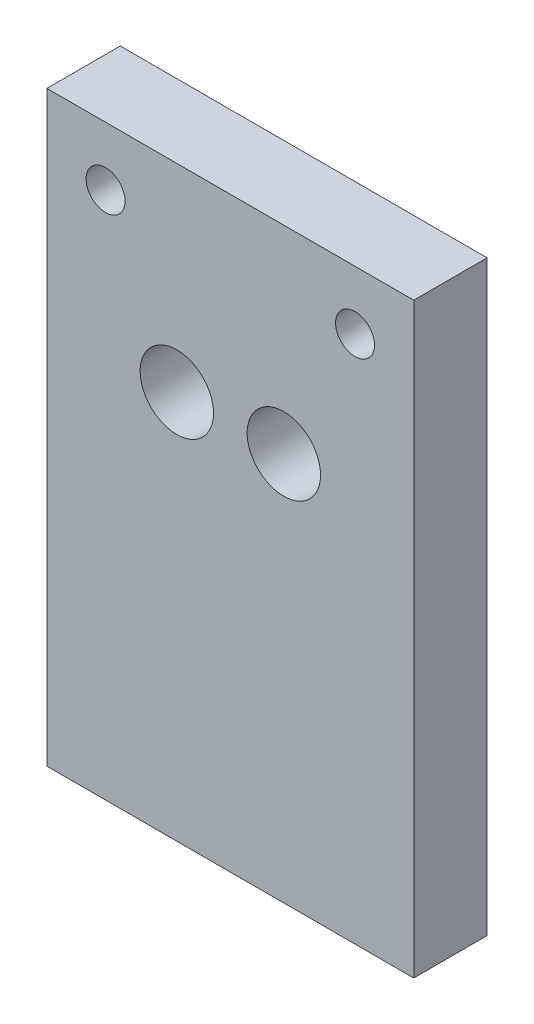
from build123d import *

# Parameters (mm, degrees)
SKETCH1_W               = 63.5
SKETCH1_H               = 134.62
SKETCH1_R               = 6.35
BOSS_EXTRUDE1_DEPTH     = 12.7
SKETCH2_W               = 63.5
SKETCH2_H               = 33.02
CUT_EXTRUDE1_DEPTH      = 76.498268854
F_1_4_CLEARANCE_HOLE1_D = 6.7564


with BuildPart() as part:
    # Sketch1 → Boss-Extrude1 (new body)
    with BuildSketch(Plane.XY):
        Rectangle(SKETCH1_W, SKETCH1_H)
        with Locations((-9.26084, 0)):
            Circle(SKETCH1_R, mode=Mode.SUBTRACT)
        with Locations((9.26084, 0)):
            Circle(SKETCH1_R, mode=Mode.SUBTRACT)
    extrude(amount=BOSS_EXTRUDE1_DEPTH)

    # Sketch2 → Cut-Extrude1 (cut, through all)
    with BuildSketch(Plane.XY.offset(12.7)):
        with Locations((0, 50.8)):
            Rectangle(SKETCH2_W, SKETCH2_H)
    extrude(amount=-CUT_EXTRUDE1_DEPTH, mode=Mode.SUBTRACT)

    # 1/4 Clearance Hole1 (through all)
    with Locations(Plane.XY.offset(12.7)):
        with Locations((-21.59, 24.13)):
            f_1_4_clearance_hole1 = Hole(F_1_4_CLEARANCE_HOLE1_D / 2)

    # Mirror1: 1/4 Clearance Hole1 across plane
    add(f_1_4_clearance_hole1.mirror(Plane(origin=(0, 0, 0), x_dir=(0, 0, 1), z_dir=(1, 0, 0))), mode=Mode.SUBTRACT)

    # Sketch8 → #10-32 Tapped Hole1 (revolve, cut)
    with BuildSketch(Plane(origin=(-21.59, -67.31, 6.35), x_dir=(0, 0, -1), z_dir=(1, 0, 0))):
        Polygon((0, 0), (0, 26.613317848), (2.0193, 25.4), (2.0193, 0), align=None)
    f_10_32_tapped_hole1 = revolve(axis=Axis((-21.59, -73.66, 6.35), (0, 1, 0)), mode=Mode.SUBTRACT)

    # Mirror2: #10-32 Tapped Hole1 across plane
    add(f_10_32_tapped_hole1.mirror(Plane(origin=(0, 0, 0), x_dir=(0, 0, 1), z_dir=(1, 0, 0))), mode=Mode.SUBTRACT)


solid = part.part
